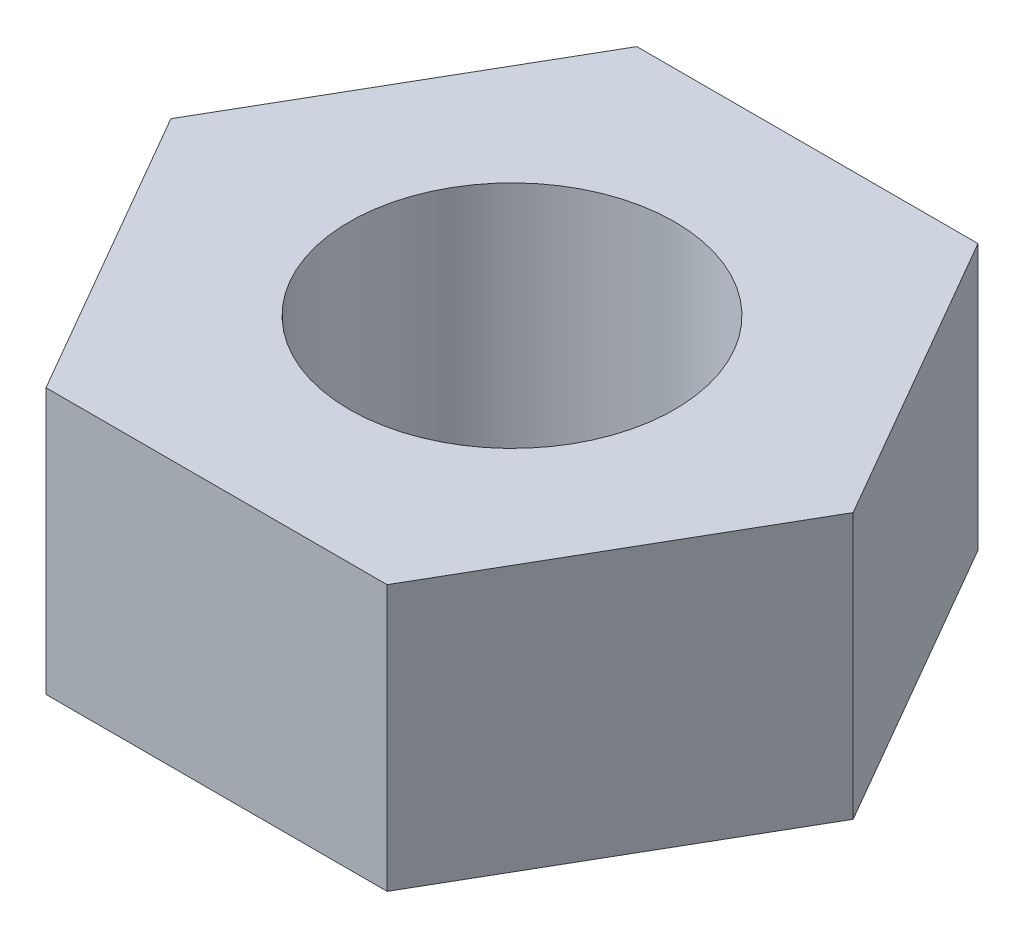
from build123d import *

# Parameters (mm, degrees)
SKETCH_1_R      = 1.5
EXTRUDE_1_DEPTH = 2.45


with BuildPart() as part:
    # 草图1 → 凸台-拉伸1 (new body)
    with BuildSketch(Plane(origin=(0, 0, 0), x_dir=(1, 0, 0), z_dir=(0, 1, 0))):
        Polygon((3.146558967, 0), (1.573279484, 2.725), (-1.573279484, 2.725), (-3.146558967, 0), (-1.573279484, -2.725), (1.573279484, -2.725), align=None)
        with Locations(Location((0, 0, 0), (0, 0, 270))):
            Circle(SKETCH_1_R, mode=Mode.SUBTRACT)
    extrude(amount=EXTRUDE_1_DEPTH)


solid = part.part
